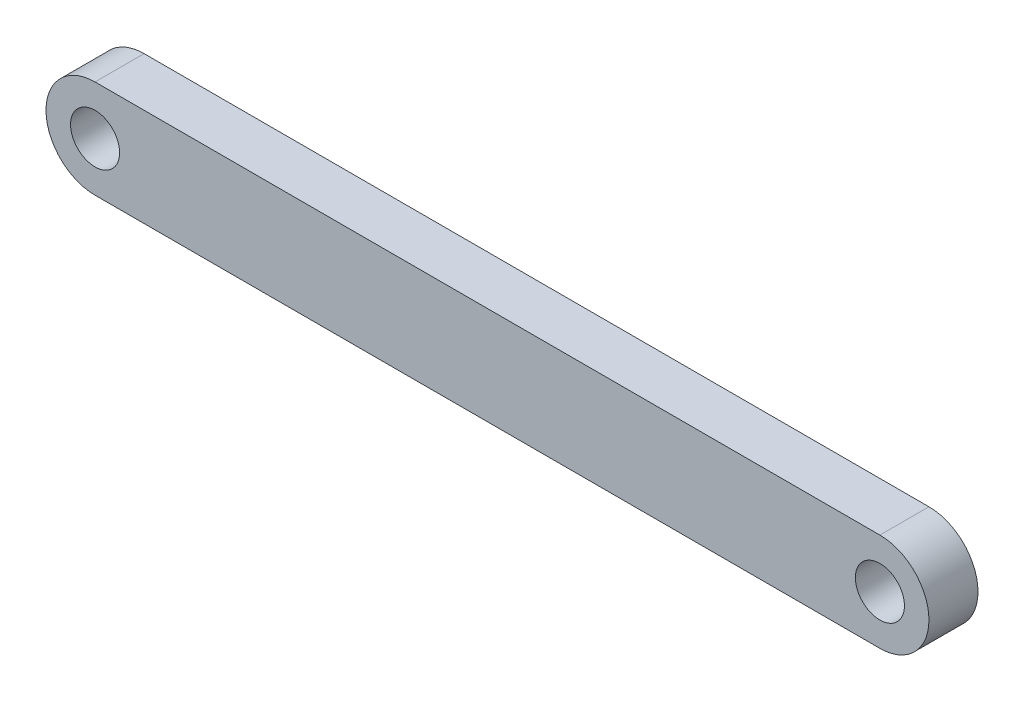
from build123d import *

# Parameters (mm, degrees)
EXTRUDE_1_DEPTH     = 10
SKETCH_2_R          = 5
CUT_EXTRUDE_1_DEPTH = 10


with BuildPart() as part:
    # 草图1 → 凸台-拉伸1 (new body)
    with BuildSketch(Plane.XY):
        with BuildLine():
            Line((-54.119402514, 6.295570654), (105.880597486, 6.295570654))
            ThreePointArc((105.880597486, 6.295570654), (115.880597486, -3.704429346), (105.880597486, -13.704429346))
            Line((105.880597486, -13.704429346), (-54.119402514, -13.704429346))
            ThreePointArc((-54.119402514, -13.704429346), (-64.119402514, -3.704429346), (-54.119402514, 6.295570654))
        make_face()
    extrude(amount=EXTRUDE_1_DEPTH)

    # 草图2 → 切除-拉伸1 (cut)
    with BuildSketch(Plane.XY.offset(10)):
        with Locations((105.880597486, -3.704429346)):
            Circle(SKETCH_2_R)
        with Locations((-54.119402514, -3.704429346)):
            Circle(SKETCH_2_R)
    extrude(amount=-CUT_EXTRUDE_1_DEPTH, mode=Mode.SUBTRACT)


solid = part.part
